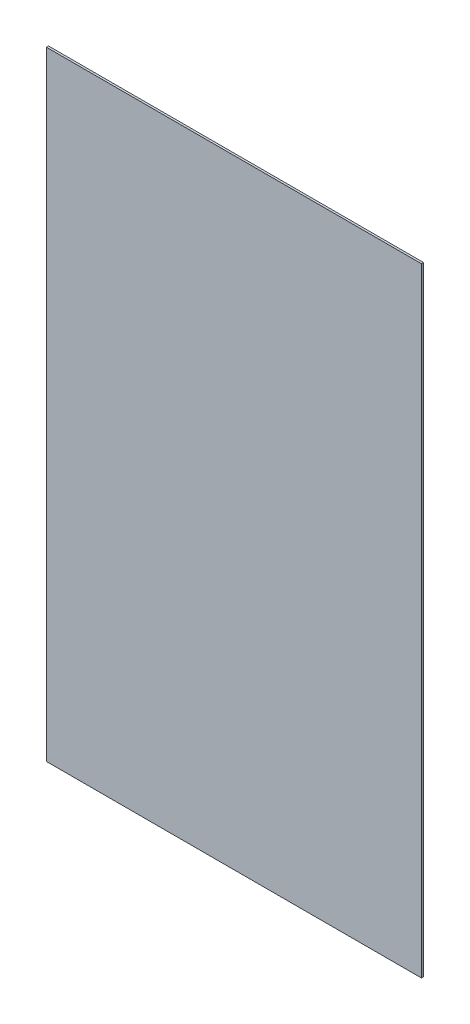
from build123d import *

# Parameters (mm, degrees)
ESBO_O1_W                = 177
ESBO_O1_H                = 292
RESSALTO_EXTRUS_O1_DEPTH = 1


with BuildPart() as part:
    # Esboço1 → Ressalto-extrusão1 (new body)
    with BuildSketch(Plane.XY):
        Rectangle(ESBO_O1_W, ESBO_O1_H)
    extrude(amount=RESSALTO_EXTRUS_O1_DEPTH)


solid = part.part
